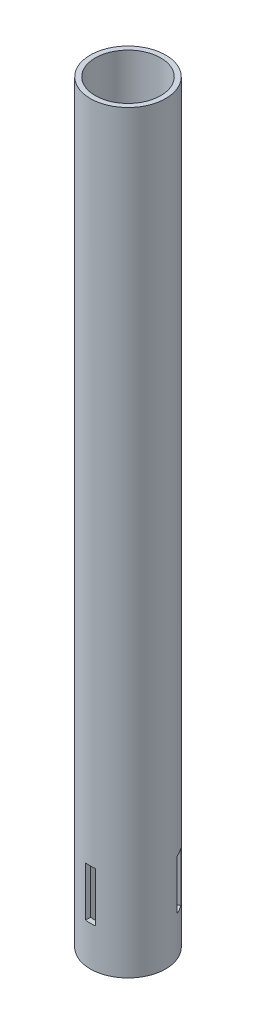
from build123d import *

# Parameters (mm, degrees)
SKETCH1_R           = 3.8
SKETCH1_R_2         = 3.3
BOSS_EXTRUDE2_DEPTH = 76
SKETCH2_W           = 1
SKETCH2_H           = 5
CUT_EXTRUDE4_DEPTH  = 8
CIRPATTERN1_COUNT   = 3
SCALE2_SCALE        = 10


with BuildPart() as part:
    # Sketch1 → Boss-Extrude2 (new body)
    with BuildSketch(Plane(origin=(0, 0, 0), x_dir=(1, 0, 0), z_dir=(0, 1, 0))):
        with Locations(Location((0, 0, 0), (0, 0, 270))):
            Circle(SKETCH1_R)
        with Locations(Location((0, 0, 0), (0, 0, 270))):
            Circle(SKETCH1_R_2, mode=Mode.SUBTRACT)
    extrude(amount=BOSS_EXTRUDE2_DEPTH)

    # Sketch2 → Cut-Extrude4 (cut)
    with BuildSketch(Plane.XY):
        with Locations((0, 6.5)):
            Rectangle(SKETCH2_W, SKETCH2_H)
    cut_extrude4 = extrude(amount=CUT_EXTRUDE4_DEPTH, mode=Mode.SUBTRACT)

    # CirPattern1: Cut-Extrude4 ×3 about axis
    cirpattern1_axis = Axis((0, 0, 0), (0, 1, 0))
    for i in range(1, CIRPATTERN1_COUNT):
        add(cut_extrude4.rotate(cirpattern1_axis, i * 360 / CIRPATTERN1_COUNT), mode=Mode.SUBTRACT)


with BuildPart() as part_1:
    # Scale2: scaled about (0, 0, 0)
    add(part.part.scale(SCALE2_SCALE))


solid = part_1.part
